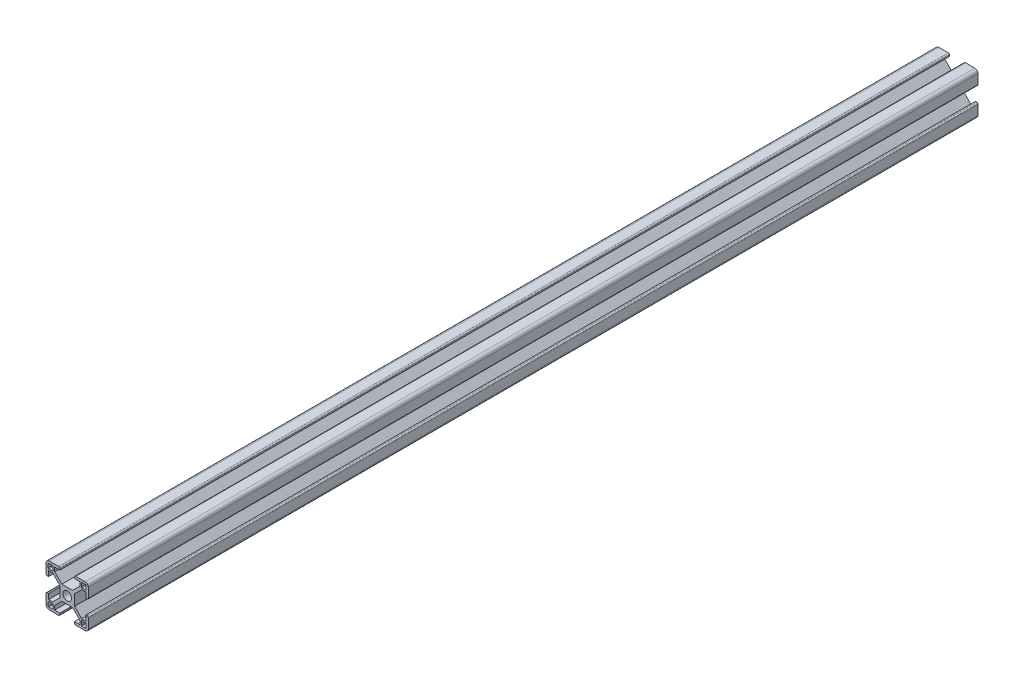
from build123d import *

# Parameters (mm, degrees)
CROQUIS1_R              = 3.4
SALIENTE_EXTRUIR3_DEPTH = 700


with BuildPart() as part:
    # Croquis1 → Saliente-Extruir3 (new body)
    with BuildSketch(Plane.XY):
        with BuildLine():
            Line((5.8, -4.24), (5.8, 4.24))
            Line((5.8, 4.24), (11.47, 9.91))
            Line((11.47, 9.91), (14.66, 9.91))
            Line((14.66, 9.91), (14.66, 5.73))
            Line((14.66, 5.73), (15.66, 5.73))
            ThreePointArc((15.66, 5.73), (16.367106781, 6.022893219), (16.66, 6.73))
            Line((16.66, 6.73), (16.66, 14.16))
            ThreePointArc((16.66, 14.16), (15.927766953, 15.927766953), (14.16, 16.66))
            Line((14.16, 16.66), (6.73, 16.66))
            ThreePointArc((6.73, 16.66), (6.022893219, 16.367106781), (5.73, 15.66))
            Line((5.73, 15.66), (5.73, 14.66))
            Line((5.73, 14.66), (9.91, 14.66))
            Line((9.91, 14.66), (9.91, 11.47))
            Line((9.91, 11.47), (4.24, 5.8))
            Line((4.24, 5.8), (-4.24, 5.8))
            Line((-4.24, 5.8), (-9.91, 11.47))
            Line((-9.91, 11.47), (-9.91, 14.66))
            Line((-9.91, 14.66), (-5.73, 14.66))
            Line((-5.73, 14.66), (-5.73, 15.66))
            ThreePointArc((-5.73, 15.66), (-6.022893219, 16.367106781), (-6.73, 16.66))
            Line((-6.73, 16.66), (-14.16, 16.66))
            ThreePointArc((-14.16, 16.66), (-15.927766953, 15.927766953), (-16.66, 14.16))
            Line((-16.66, 14.16), (-16.66, 6.73))
            ThreePointArc((-16.66, 6.73), (-16.367106781, 6.022893219), (-15.66, 5.73))
            Line((-15.66, 5.73), (-14.66, 5.73))
            Line((-14.66, 5.73), (-14.66, 9.91))
            Line((-14.66, 9.91), (-11.47, 9.91))
            Line((-11.47, 9.91), (-5.8, 4.24))
            Line((-5.8, 4.24), (-5.8, -4.24))
            Line((-5.8, -4.24), (-11.47, -9.91))
            Line((-11.47, -9.91), (-14.66, -9.91))
            Line((-14.66, -9.91), (-14.66, -5.73))
            Line((-14.66, -5.73), (-15.66, -5.73))
            ThreePointArc((-15.66, -5.73), (-16.367106781, -6.022893219), (-16.66, -6.73))
            Line((-16.66, -6.73), (-16.66, -14.16))
            ThreePointArc((-16.66, -14.16), (-15.927766953, -15.927766953), (-14.16, -16.66))
            Line((-14.16, -16.66), (-6.73, -16.66))
            ThreePointArc((-6.73, -16.66), (-6.022893219, -16.367106781), (-5.73, -15.66))
            Line((-5.73, -15.66), (-5.73, -14.66))
            Line((-5.73, -14.66), (-9.91, -14.66))
            Line((-9.91, -14.66), (-9.91, -11.47))
            Line((-9.91, -11.47), (-4.24, -5.8))
            Line((-4.24, -5.8), (4.24, -5.8))
            Line((4.24, -5.8), (9.91, -11.47))
            Line((9.91, -11.47), (9.91, -14.66))
            Line((9.91, -14.66), (5.73, -14.66))
            Line((5.73, -14.66), (5.73, -15.66))
            ThreePointArc((5.73, -15.66), (6.022893219, -16.367106781), (6.73, -16.66))
            Line((6.73, -16.66), (14.16, -16.66))
            ThreePointArc((14.16, -16.66), (15.927766953, -15.927766953), (16.66, -14.16))
            Line((16.66, -14.16), (16.66, -6.73))
            ThreePointArc((16.66, -6.73), (16.367106781, -6.022893219), (15.66, -5.73))
            Line((15.66, -5.73), (14.66, -5.73))
            Line((14.66, -5.73), (14.66, -9.91))
            Line((14.66, -9.91), (11.47, -9.91))
            Line((11.47, -9.91), (5.8, -4.24))
        make_face()
        Circle(CROQUIS1_R, mode=Mode.SUBTRACT)
        with BuildLine():
            Line((11.651495134, 14.901495134), (14.401495134, 14.901495134))
            ThreePointArc((14.401495134, 14.901495134), (14.755048524, 14.755048524), (14.901495134, 14.401495134))
            Line((14.901495134, 14.401495134), (14.901495134, 11.651495134))
            ThreePointArc((14.901495134, 11.651495134), (14.755048524, 11.297941743), (14.401495134, 11.151495134))
            Line((14.401495134, 11.151495134), (11.651495134, 11.151495134))
            ThreePointArc((11.651495134, 11.151495134), (11.297941743, 11.297941743), (11.151495134, 11.651495134))
            Line((11.151495134, 11.651495134), (11.151495134, 14.401495134))
            ThreePointArc((11.151495134, 14.401495134), (11.297941743, 14.755048524), (11.651495134, 14.901495134))
        make_face(mode=Mode.SUBTRACT)
        with BuildLine():
            Line((-14.901495134, 14.401495134), (-14.901495134, 11.651495134))
            ThreePointArc((-14.901495134, 11.651495134), (-14.755048524, 11.297941743), (-14.401495134, 11.151495134))
            Line((-14.401495134, 11.151495134), (-11.651495134, 11.151495134))
            ThreePointArc((-11.651495134, 11.151495134), (-11.297941743, 11.297941743), (-11.151495134, 11.651495134))
            Line((-11.151495134, 11.651495134), (-11.151495134, 14.401495134))
            ThreePointArc((-11.151495134, 14.401495134), (-11.297941743, 14.755048524), (-11.651495134, 14.901495134))
            Line((-11.651495134, 14.901495134), (-14.401495134, 14.901495134))
            ThreePointArc((-14.401495134, 14.901495134), (-14.755048524, 14.755048524), (-14.901495134, 14.401495134))
        make_face(mode=Mode.SUBTRACT)
        with BuildLine():
            Line((-11.651495134, -14.901495134), (-14.401495134, -14.901495134))
            ThreePointArc((-14.401495134, -14.901495134), (-14.755048524, -14.755048524), (-14.901495134, -14.401495134))
            Line((-14.901495134, -14.401495134), (-14.901495134, -11.651495134))
            ThreePointArc((-14.901495134, -11.651495134), (-14.755048524, -11.297941743), (-14.401495134, -11.151495134))
            Line((-14.401495134, -11.151495134), (-11.651495134, -11.151495134))
            ThreePointArc((-11.651495134, -11.151495134), (-11.297941743, -11.297941743), (-11.151495134, -11.651495134))
            Line((-11.151495134, -11.651495134), (-11.151495134, -14.401495134))
            ThreePointArc((-11.151495134, -14.401495134), (-11.297941743, -14.755048524), (-11.651495134, -14.901495134))
        make_face(mode=Mode.SUBTRACT)
        with BuildLine():
            Line((14.901495134, -14.401495134), (14.901495134, -11.651495134))
            ThreePointArc((14.901495134, -11.651495134), (14.755048524, -11.297941743), (14.401495134, -11.151495134))
            Line((14.401495134, -11.151495134), (11.651495134, -11.151495134))
            ThreePointArc((11.651495134, -11.151495134), (11.297941743, -11.297941743), (11.151495134, -11.651495134))
            Line((11.151495134, -11.651495134), (11.151495134, -14.401495134))
            ThreePointArc((11.151495134, -14.401495134), (11.297941743, -14.755048524), (11.651495134, -14.901495134))
            Line((11.651495134, -14.901495134), (14.401495134, -14.901495134))
            ThreePointArc((14.401495134, -14.901495134), (14.755048524, -14.755048524), (14.901495134, -14.401495134))
        make_face(mode=Mode.SUBTRACT)
    extrude(amount=SALIENTE_EXTRUIR3_DEPTH)


solid = part.part
